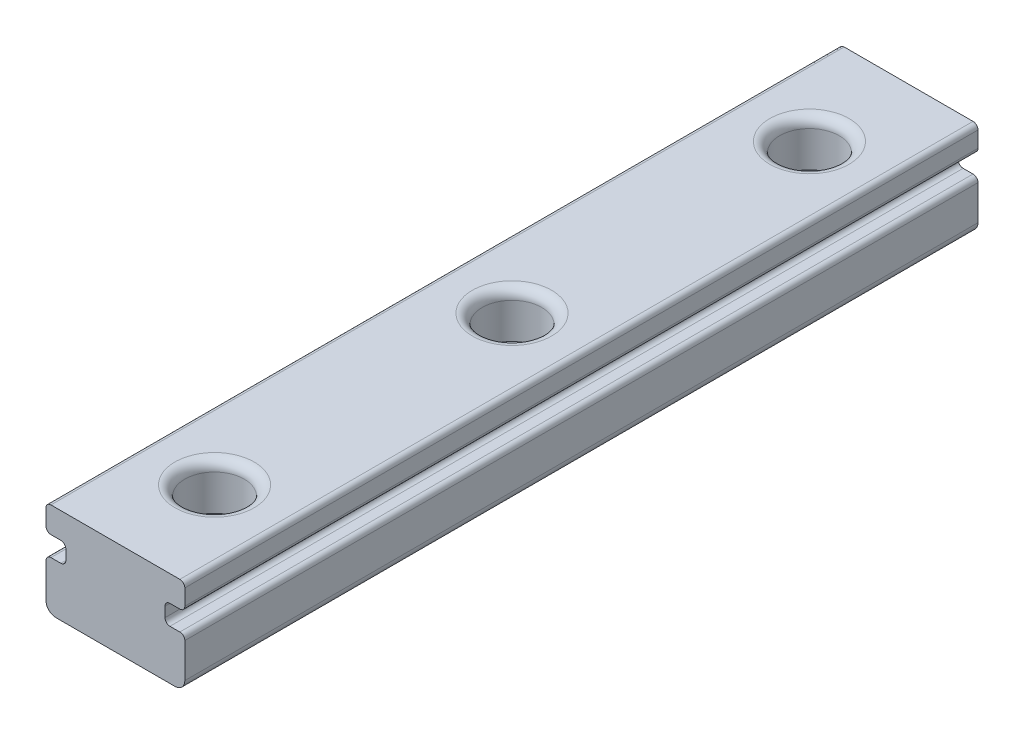
from build123d import *

# Parameters (mm, degrees)
EXTRUDE_1_DEPTH                = 40
FILLET_1_R                     = 0.25
FILLET_2_R                     = 0.5
SKETCH_2_R                     = 1.5
CUT_EXTRUDE_1_DEPTH            = 2.3
SKETCH_3_R                     = 1.2
CUT_EXTRUDE_2_DEPTH            = 41.684763733
FILLET_3_R                     = 0.5
PATTERN_LINEAR_2_COUNT         = 3
PATTERN_LINEAR_2_PITCH         = 15
FILLET_3_OF_PATTERN_LINEAR_2_R = 0.5


with BuildPart() as part:
    # 草图1 → 凸台-拉伸1 (new body)
    with BuildSketch(Plane.XY):
        Polygon((7, 2.5), (7, 0), (0, 0), (0, 2.5), (1, 2.5), (1, 3.5), (0, 3.5), (0, 4.8), (7, 4.8), (7, 3.5), (6, 3.5), (6, 2.5), align=None)
    extrude(amount=EXTRUDE_1_DEPTH)

    # 圆角1
    fillet_1_edges = [part.edges().sort_by_distance(p)[0] for p in [
        (0, 2.5, 20),
        (1, 2.5, 20),
        (1, 3.5, 20),
        (0, 3.5, 20),
        (0, 4.8, 20),
        (7, 4.8, 20),
        (7, 3.5, 20),
        (6, 3.5, 20),
        (6, 2.5, 20),
        (7, 2.5, 20),
    ]]
    fillet(fillet_1_edges, radius=FILLET_1_R)

    # 圆角2
    fillet_2_edges = [part.edges().sort_by_distance(p)[0] for p in [
        (7, 0, 20),
        (0, 0, 20),
    ]]
    fillet(fillet_2_edges, radius=FILLET_2_R)

    # 草图2 → 切除-拉伸1 (cut)
    with BuildSketch(Plane(origin=(0, 4.8, 0), x_dir=(1, 0, 0), z_dir=(0, 1, 0))):
        with Locations(Location((3.5, -5, 0), (0, 0, 270))):
            Circle(SKETCH_2_R)
    cut_extrude_1 = extrude(amount=-CUT_EXTRUDE_1_DEPTH, mode=Mode.SUBTRACT)

    # 草图3 → 切除-拉伸2 (cut, through all)
    with BuildSketch(Plane(origin=(0, 2.5, 0), x_dir=(1, 0, 0), z_dir=(0, 1, 0))):
        with Locations(Location((3.5, -5, 0), (0, 0, 270))):
            Circle(SKETCH_3_R)
    cut_extrude_2 = extrude(amount=-CUT_EXTRUDE_2_DEPTH, mode=Mode.SUBTRACT)

    # 圆角3
    fillet_3_edges = [part.edges().sort_by_distance(p)[0] for p in [
        (3.5, 4.8, 3.5),
    ]]
    fillet(fillet_3_edges, radius=FILLET_3_R)

    # 阵列(线性)2: 切除-拉伸1, 切除-拉伸2 ×3
    with Locations(*[(0, 0, i * PATTERN_LINEAR_2_PITCH) for i in range(1, PATTERN_LINEAR_2_COUNT)]):
        add(cut_extrude_1, mode=Mode.SUBTRACT)
        add(cut_extrude_2, mode=Mode.SUBTRACT)

    # 圆角3 of 阵列(线性)2
    fillet_3_of_pattern_linear_2_edges = [part.edges().sort_by_distance(p)[0] for p in [
        (3.5, 4.8, 18.5),
        (3.5, 4.8, 33.5),
    ]]
    fillet(fillet_3_of_pattern_linear_2_edges, radius=FILLET_3_OF_PATTERN_LINEAR_2_R)


solid = part.part
